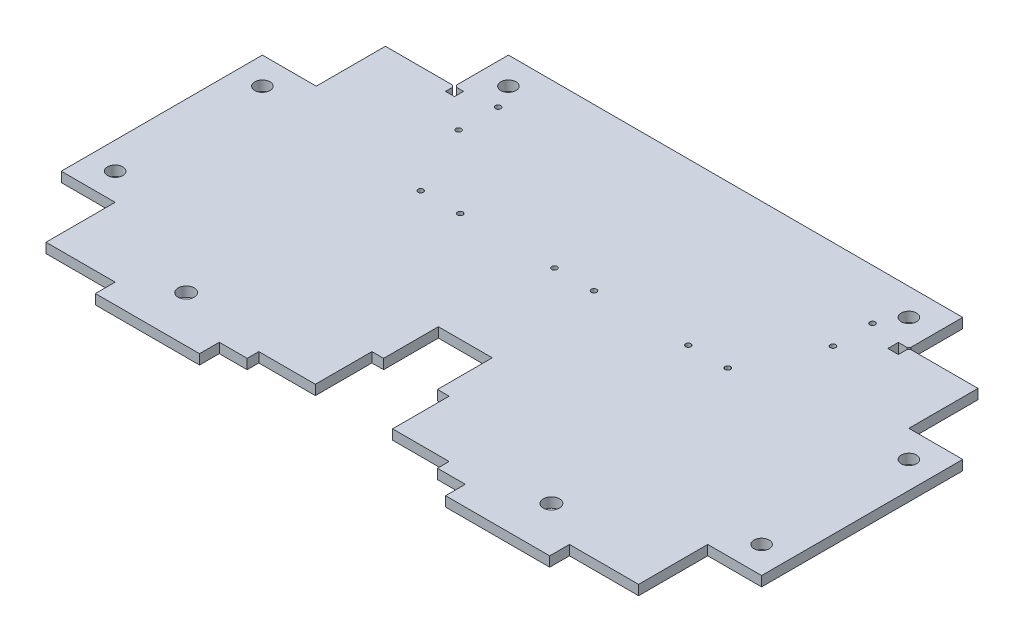
from build123d import *

# Parameters (mm, degrees)
CROQUIS1_W              = 390
CROQUIS1_H              = 230
SALIENTE_EXTRUIR1_DEPTH = 5.5
CROQUIS2_W              = 30
CROQUIS2_H              = 30
CORTAR_EXTRUIR1_DEPTH   = 5.5
CROQUIS3_W              = 38.5
CROQUIS3_H              = 30
CORTAR_EXTRUIR2_DEPTH   = 5.5
CROQUIS4_W              = 30
CROQUIS4_H              = 38.5
CORTAR_EXTRUIR3_DEPTH   = 5.5
CROQUIS5_W              = 30
CROQUIS5_H              = 38.5
CORTAR_EXTRUIR4_DEPTH   = 5.5
CROQUIS6_W              = 68.5
CROQUIS6_H              = 11
CORTAR_EXTRUIR5_DEPTH   = 5.5
CROQUIS7_W              = 68.5
CROQUIS7_H              = 11
CORTAR_EXTRUIR6_DEPTH   = 5.5
CROQUIS8_W              = 30
CROQUIS8_H              = 30
CORTAR_EXTRUIR7_DEPTH   = 5.5
CROQUIS9_W              = 30
CROQUIS9_H              = 38.5
CORTAR_EXTRUIR8_DEPTH   = 5.5
CROQUIS10_R             = 4.25
CORTAR_EXTRUIR9_DEPTH   = 5.5
CORTAR_EXTRUIR10_DEPTH  = 5.5
CORTAR_EXTRUIR11_DEPTH  = 5.5
CROQUIS13_W             = 5.857775835
CROQUIS13_H             = 5.857775835
CORTAR_EXTRUIR12_DEPTH  = 5.5
CORTAR_EXTRUIR13_DEPTH  = 5.5
CORTAR_EXTRUIR14_DEPTH  = 5.5
CROQUIS16_W             = 5
CROQUIS16_H             = 5
CORTAR_EXTRUIR15_DEPTH  = 5.5
CROQUIS17_R             = 4.5
CORTAR_EXTRUIR16_DEPTH  = 10
CORTAR_EXTRUIR17_DEPTH  = 10
CROQUIS19_R             = 1.5
CORTAR_EXTRUIR19_DEPTH  = 10
CROQUIS20_W             = 30
CROQUIS20_H             = 38.5
CORTAR_EXTRUIR20_DEPTH  = 10
CROQUIS21_R             = 4.25
CORTAR_EXTRUIR21_DEPTH  = 10
CROQUIS22_R             = 4.25
SALIENTE_EXTRUIR2_DEPTH = 10
CROQUIS23_W             = 8.291515613
CROQUIS23_H             = 2.906343814
CROQUIS23_W_2           = 14.865311346
CROQUIS23_H_2           = 4.543446559
CORTAR_EXTRUIR22_DEPTH  = 10
CROQUIS24_W             = 38.5
CROQUIS24_H             = 11
CORTAR_EXTRUIR23_DEPTH  = 10
CROQUIS25_W             = 38.5
CROQUIS25_H             = 11
CORTAR_EXTRUIR24_DEPTH  = 10
CROQUIS26_W             = 403.89450598
CROQUIS26_H             = 21.330606429
CORTAR_EXTRUIR25_DEPTH  = 10


with BuildPart() as part:
    # Croquis1 → Saliente-Extruir1 (new body)
    with BuildSketch(Plane(origin=(0, 0, 0), x_dir=(1, 0, 0), z_dir=(0, 1, 0))):
        Rectangle(CROQUIS1_W, CROQUIS1_H)
    extrude(amount=SALIENTE_EXTRUIR1_DEPTH)

    # Croquis2 → Cortar-Extruir1 (cut)
    with BuildSketch(Plane(origin=(0, 5.5, 0), x_dir=(1, 0, 0), z_dir=(0, 1, 0))):
        with Locations((-180, 100)):
            Rectangle(CROQUIS2_W, CROQUIS2_H)
        with Locations((180, 100)):
            Rectangle(CROQUIS2_W, CROQUIS2_H)
    extrude(amount=-CORTAR_EXTRUIR1_DEPTH, mode=Mode.SUBTRACT)

    # Croquis3 → Cortar-Extruir2 (cut)
    with BuildSketch(Plane(origin=(0, 5.5, 0), x_dir=(1, 0, 0), z_dir=(0, 1, 0))):
        with Locations((-145.75, 100)):
            Rectangle(CROQUIS3_W, CROQUIS3_H)
        with Locations((145.75, 100)):
            Rectangle(CROQUIS3_W, CROQUIS3_H)
    extrude(amount=-CORTAR_EXTRUIR2_DEPTH, mode=Mode.SUBTRACT)

    # Croquis4 → Cortar-Extruir3 (cut)
    with BuildSketch(Plane(origin=(0, 5.5, 0), x_dir=(1, 0, 0), z_dir=(0, 1, 0))):
        with Locations((-180, 65.75)):
            Rectangle(CROQUIS4_W, CROQUIS4_H)
        with Locations((180, 65.75)):
            Rectangle(CROQUIS4_W, CROQUIS4_H)
    extrude(amount=-CORTAR_EXTRUIR3_DEPTH, mode=Mode.SUBTRACT)

    # Croquis5 → Cortar-Extruir4 (cut)
    with BuildSketch(Plane(origin=(0, 5.5, 0), x_dir=(1, 0, 0), z_dir=(0, 1, 0))):
        with Locations((-180, -95.75)):
            Rectangle(CROQUIS5_W, CROQUIS5_H)
        with Locations((180, -95.75)):
            Rectangle(CROQUIS5_W, CROQUIS5_H)
    extrude(amount=-CORTAR_EXTRUIR4_DEPTH, mode=Mode.SUBTRACT)

    # Croquis6 → Cortar-Extruir5 (cut)
    with BuildSketch(Plane(origin=(0, 5.5, 0), x_dir=(1, 0, 0), z_dir=(0, 1, 0))):
        with Locations((34.25, -109.5)):
            Rectangle(CROQUIS6_W, CROQUIS6_H)
    extrude(amount=-CORTAR_EXTRUIR5_DEPTH, mode=Mode.SUBTRACT)

    # Croquis7 → Cortar-Extruir6 (cut)
    with BuildSketch(Plane(origin=(0, 5.5, 0), x_dir=(1, 0, 0), z_dir=(0, 1, 0))):
        with Locations((-34.25, -109.5)):
            Rectangle(CROQUIS7_W, CROQUIS7_H)
    extrude(amount=-CORTAR_EXTRUIR6_DEPTH, mode=Mode.SUBTRACT)

    # Croquis8 → Cortar-Extruir7 (cut)
    with BuildSketch(Plane(origin=(0, 5.5, 0), x_dir=(1, 0, 0), z_dir=(0, 1, 0))):
        with Locations((0, -89)):
            Rectangle(CROQUIS8_W, CROQUIS8_H)
    extrude(amount=-CORTAR_EXTRUIR7_DEPTH, mode=Mode.SUBTRACT)

    # Croquis9 → Cortar-Extruir8 (cut)
    with BuildSketch(Plane(origin=(0, 5.5, 0), x_dir=(1, 0, 0), z_dir=(0, 1, 0))):
        with Locations((0, -54.75)):
            Rectangle(CROQUIS9_W, CROQUIS9_H)
    extrude(amount=-CORTAR_EXTRUIR8_DEPTH, mode=Mode.SUBTRACT)

    # Croquis10 → Cortar-Extruir9 (cut)
    with BuildSketch(Plane(origin=(0, 5.5, 0), x_dir=(1, 0, 0), z_dir=(0, 1, 0))):
        with Locations(Location((-111.5, 100, 0), (0, 0, 270))):
            Circle(CROQUIS10_R)
        with Locations(Location((111.5, 100, 0), (0, 0, 270))):
            Circle(CROQUIS10_R)
        with Locations(Location((-180, 31.5, 0), (0, 0, 270))):
            Circle(CROQUIS10_R)
        with Locations(Location((-180, -61.5, 0), (0, 0, 270))):
            Circle(CROQUIS10_R)
        with Locations(Location((180, 31.5, 0), (0, 0, 270))):
            Circle(CROQUIS10_R)
        with Locations(Location((180, -61.5, 0), (0, 0, 270))):
            Circle(CROQUIS10_R)
    extrude(amount=-CORTAR_EXTRUIR9_DEPTH, mode=Mode.SUBTRACT)

    # Croquis11 → Cortar-Extruir10 (cut)
    with BuildSketch(Plane(origin=(0, 5.5, 0), x_dir=(1, 0, 0), z_dir=(0, 1, 0))):
        Polygon((126.5, 85), (127.25, 85), (126.5, 84.25), (125.75, 85), (126.5, 85.75), align=None)
    extrude(amount=-CORTAR_EXTRUIR10_DEPTH, mode=Mode.SUBTRACT)

    # Croquis12 → Cortar-Extruir11 (cut)
    with BuildSketch(Plane(origin=(0, 5.5, 0), x_dir=(1, 0, 0), z_dir=(0, 1, 0))):
        Polygon((125.75, 85), (125.573223305, 85.176776695), (126.5, 86.103553391), (127.603553391, 85), (126.676776695, 84.073223305), align=None)
    extrude(amount=-CORTAR_EXTRUIR11_DEPTH, mode=Mode.SUBTRACT)

    # Croquis13 → Cortar-Extruir12 (cut)
    with BuildSketch(Plane(origin=(0, 5.5, 0), x_dir=(1, 0, 0), z_dir=(0, 1, 0))):
        with Locations((123.571112083, 82.071112083)):
            Rectangle(CROQUIS13_W, CROQUIS13_H)
    extrude(amount=-CORTAR_EXTRUIR12_DEPTH, mode=Mode.SUBTRACT)

    # Croquis14 → Cortar-Extruir13 (cut)
    with BuildSketch(Plane(origin=(0, 5.5, 0), x_dir=(1, 0, 0), z_dir=(0, 1, 0))):
        Polygon((125.770357071, 85.373910462), (126.873910462, 84.270357071), (125.903673954, 83.300120564), (124.800120564, 84.403673954), align=None)
    extrude(amount=-CORTAR_EXTRUIR13_DEPTH, mode=Mode.SUBTRACT)

    # Croquis15 → Cortar-Extruir14 (cut)
    with BuildSketch(Plane(origin=(0, 5.5, 0), x_dir=(1, 0, 0), z_dir=(0, 1, 0))):
        Polygon((-126.5, 85), (-126.5, 86.1), (-125.4, 85), (-126.5, 83.9), (-127.6, 85), align=None)
    extrude(amount=-CORTAR_EXTRUIR14_DEPTH, mode=Mode.SUBTRACT)

    # Croquis16 → Cortar-Extruir15 (cut)
    with BuildSketch(Plane(origin=(0, 5.5, 0), x_dir=(1, 0, 0), z_dir=(0, 1, 0))):
        with Locations((-124, 82.5)):
            Rectangle(CROQUIS16_W, CROQUIS16_H)
    extrude(amount=-CORTAR_EXTRUIR15_DEPTH, mode=Mode.SUBTRACT)

    # Croquis17 → Cortar-Extruir16 (cut)
    with BuildSketch(Plane(origin=(0, 5.5, 0), x_dir=(1, 0, 0), z_dir=(0, 1, 0))):
        with Locations(Location((-101.7, -89.25, 0), (0, 0, 270))):
            Circle(CROQUIS17_R)
        with Locations(Location((101.7, -89.25, 0), (0, 0, 270))):
            Circle(CROQUIS17_R)
    extrude(amount=-CORTAR_EXTRUIR16_DEPTH, mode=Mode.SUBTRACT)

    # Croquis18 → Cortar-Extruir17 (cut)
    with BuildSketch(Plane(origin=(0, 5.5, 0), x_dir=(1, 0, 0), z_dir=(0, 1, 0))):
        Polygon((-15, -104), (-53, -104), (-53, -97.5), (-21.5, -97.5), (-21.5, -66), (-15, -66), align=None)
        Polygon((15, -66), (15, -104), (53, -104), (53, -97.5), (21.5, -97.5), (21.5, -66), align=None)
    extrude(amount=-CORTAR_EXTRUIR17_DEPTH, mode=Mode.SUBTRACT)

    # Croquis19 → Cortar-Extruir19 (cut)
    with BuildSketch(Plane(origin=(0, 5.5, 0), x_dir=(1, 0, 0), z_dir=(0, 1, 0))):
        with Locations(Location((-85.5, 25.15, 0), (0, 0, 270))):
            Circle(CROQUIS19_R)
        with Locations(Location((-63.5, 25.15, 0), (0, 0, 270))):
            Circle(CROQUIS19_R)
        with Locations(Location((-11, 25.15, 0), (0, 0, 270))):
            Circle(CROQUIS19_R)
        with Locations(Location((11, 25.15, 0), (0, 0, 270))):
            Circle(CROQUIS19_R)
        with Locations(Location((63.5, 25.15, 0), (0, 0, 270))):
            Circle(CROQUIS19_R)
        with Locations(Location((85.5, 25.15, 0), (0, 0, 270))):
            Circle(CROQUIS19_R)
        with Locations(Location((-104.25, 87, 0), (0, 0, 270))):
            Circle(CROQUIS19_R)
        with Locations(Location((-104.25, 65, 0), (0, 0, 270))):
            Circle(CROQUIS19_R)
        with Locations(Location((104.25, 87, 0), (0, 0, 270))):
            Circle(CROQUIS19_R)
        with Locations(Location((104.25, 65, 0), (0, 0, 270))):
            Circle(CROQUIS19_R)
    extrude(amount=-CORTAR_EXTRUIR19_DEPTH, mode=Mode.SUBTRACT)

    # Croquis20 → Cortar-Extruir20 (cut)
    with BuildSketch(Plane(origin=(0, 5.5, 0), x_dir=(1, 0, 0), z_dir=(0, 1, 0))):
        with Locations((180, -84.75)):
            Rectangle(CROQUIS20_W, CROQUIS20_H)
        with Locations((-180, -84.75)):
            Rectangle(CROQUIS20_W, CROQUIS20_H)
    extrude(amount=-CORTAR_EXTRUIR20_DEPTH, mode=Mode.SUBTRACT)

    # Croquis21 → Cortar-Extruir21 (cut)
    with BuildSketch(Plane(origin=(0, 5.5, 0), x_dir=(1, 0, 0), z_dir=(0, 1, 0))):
        with Locations(Location((180, -50.5, 0), (0, 0, 270))):
            Circle(CROQUIS21_R)
        with Locations(Location((-180, -50.5, 0), (0, 0, 270))):
            Circle(CROQUIS21_R)
    extrude(amount=-CORTAR_EXTRUIR21_DEPTH, mode=Mode.SUBTRACT)

    # Croquis22 → Saliente-Extruir2 (add)
    with BuildSketch(Plane(origin=(0, 5.5, 0), x_dir=(1, 0, 0), z_dir=(0, 1, 0))):
        with Locations(Location((-180, -61.5, 0), (0, 0, 270))):
            Circle(CROQUIS22_R)
        with Locations(Location((180, -61.5, 0), (0, 0, 270))):
            Circle(CROQUIS22_R)
    extrude(amount=-SALIENTE_EXTRUIR2_DEPTH)

    # Croquis23 → Cortar-Extruir22 (cut)
    with BuildSketch(Plane(origin=(0, 5.5, 0), x_dir=(1, 0, 0), z_dir=(0, 1, 0))):
        with Locations((180.153411618, -66.953171907)):
            Rectangle(CROQUIS23_W, CROQUIS23_H)
        with Locations((-178.231952533, -67.77172328)):
            Rectangle(CROQUIS23_W_2, CROQUIS23_H_2)
    extrude(amount=-CORTAR_EXTRUIR22_DEPTH, mode=Mode.SUBTRACT)

    # Croquis24 → Cortar-Extruir23 (cut)
    with BuildSketch(Plane(origin=(0, 5.5, 0), x_dir=(1, 0, 0), z_dir=(0, 1, 0))):
        with Locations((145.75, -109.5)):
            Rectangle(CROQUIS24_W, CROQUIS24_H)
    extrude(amount=-CORTAR_EXTRUIR23_DEPTH, mode=Mode.SUBTRACT)

    # Croquis25 → Cortar-Extruir24 (cut)
    with BuildSketch(Plane(origin=(0, 5.5, 0), x_dir=(1, 0, 0), z_dir=(0, 1, 0))):
        with Locations((-145.75, -109.5)):
            Rectangle(CROQUIS25_W, CROQUIS25_H)
    extrude(amount=-CORTAR_EXTRUIR24_DEPTH, mode=Mode.SUBTRACT)

    # Croquis26 → Cortar-Extruir25 (cut)
    with BuildSketch(Plane.XY.offset(65.5)):
        with Locations((6.94725299, -10.665303215)):
            Rectangle(CROQUIS26_W, CROQUIS26_H)
    extrude(amount=-CORTAR_EXTRUIR25_DEPTH, mode=Mode.SUBTRACT)


solid = part.part
